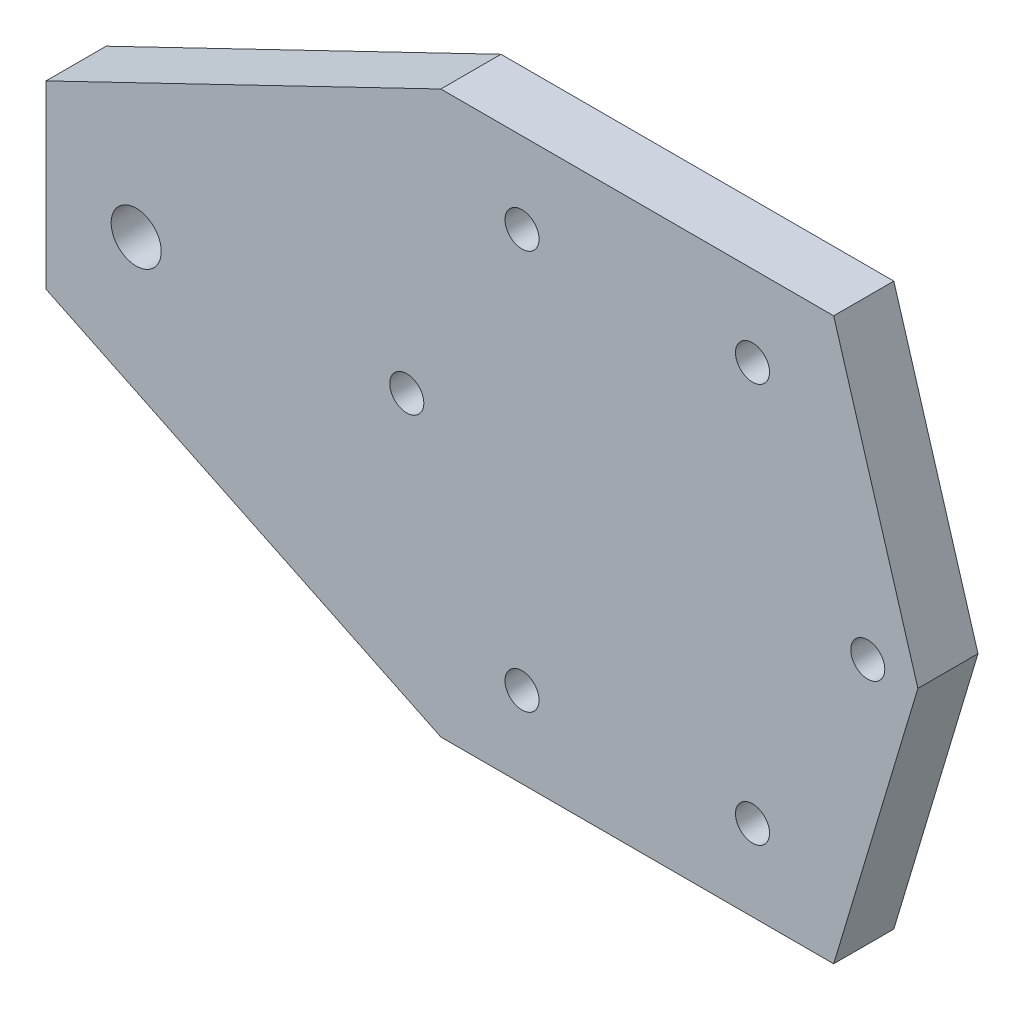
from build123d import *

# Parameters (mm, degrees)
SK_CRANK_PLATE_R   = 1.7
SK_CRANK_PLATE_R_2 = 2.5
CRANK_PLATE_DEPTH  = 6
SK_PILOT_RECESS_R  = 17.15
PILOT_RECESS_DEPTH = 2.2


with BuildPart() as part:
    # SK_Crank_Plate → Crank_Plate (new body)
    with BuildSketch(Plane.XY):
        Polygon((-59, -9), (-19.6, -28), (19.6, -28), (28, 0), (19.6, 28), (-19.6, 28), (-59, 9), align=None)
        with Locations((23, 0)):
            Circle(SK_CRANK_PLATE_R, mode=Mode.SUBTRACT)
        with Locations((11.5, 19.918584287)):
            Circle(SK_CRANK_PLATE_R, mode=Mode.SUBTRACT)
        with Locations((-11.5, 19.918584287)):
            Circle(SK_CRANK_PLATE_R, mode=Mode.SUBTRACT)
        with Locations((-23, 0)):
            Circle(SK_CRANK_PLATE_R, mode=Mode.SUBTRACT)
        with Locations((-11.5, -19.918584287)):
            Circle(SK_CRANK_PLATE_R, mode=Mode.SUBTRACT)
        with Locations((11.5, -19.918584287)):
            Circle(SK_CRANK_PLATE_R, mode=Mode.SUBTRACT)
        with Locations((-50, 0)):
            Circle(SK_CRANK_PLATE_R_2, mode=Mode.SUBTRACT)
    extrude(amount=CRANK_PLATE_DEPTH)

    # SK_Pilot_Recess → Pilot_Recess (cut)
    with BuildSketch(Plane.XY):
        Circle(SK_PILOT_RECESS_R)
    extrude(amount=PILOT_RECESS_DEPTH, mode=Mode.SUBTRACT)


solid = part.part
